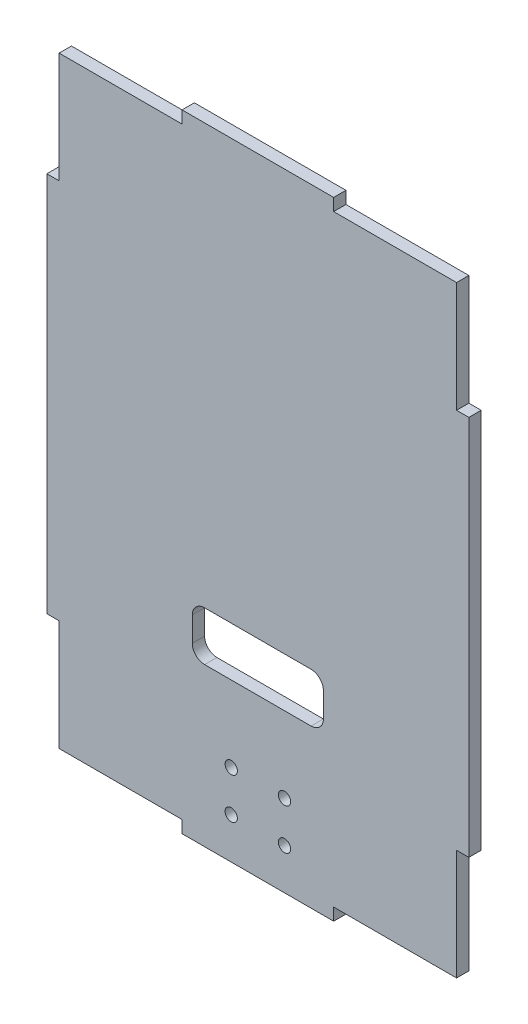
from build123d import *

# Parameters (mm, degrees)
ESBO_O1_W                = 103
ESBO_O1_H                = 153
RESSALTO_EXTRUS_O1_DEPTH = 3
ESBO_O2_W                = 32
ESBO_O2_H                = 12
CORTE_EXTRUS_O1_DEPTH    = 93.268629555
FILETE1_R                = 3
ESBO_O3_W                = 33
ESBO_O3_H                = 3
CORTE_EXTRUS_O2_DEPTH    = 93.268629555
ESBO_O4_W                = 3
ESBO_O4_H                = 27
ESBO_O4_R                = 1.5
CORTE_EXTRUS_O3_DEPTH    = 93.268629555


with BuildPart() as part:
    # Esboço1 → Ressalto-extrusão1 (new body)
    with BuildSketch(Plane.XY):
        Rectangle(ESBO_O1_W, ESBO_O1_H)
    extrude(amount=RESSALTO_EXTRUS_O1_DEPTH)

    # Esboço2 → Corte-extrusão1 (cut, through all)
    with BuildSketch(Plane.XY.offset(3)):
        with Locations((0, -32)):
            Rectangle(ESBO_O2_W, ESBO_O2_H)
    extrude(amount=-CORTE_EXTRUS_O1_DEPTH, mode=Mode.SUBTRACT)

    # Filete1
    filete1_edges = [part.edges().sort_by_distance(p)[0] for p in [
        (16, -26, 1.5),
        (16, -38, 1.5),
        (-16, -38, 1.5),
        (-16, -26, 1.5),
    ]]
    fillet(filete1_edges, radius=FILETE1_R)

    # Esboço3 → Corte-extrusão2 (cut, through all)
    with BuildSketch(Plane(origin=(0, 0, 0), x_dir=(-1, 0, 0), z_dir=(0, 0, -1))):
        with Locations((35, -75)):
            Rectangle(ESBO_O3_W, ESBO_O3_H)
        with Locations((-35, -75)):
            Rectangle(ESBO_O3_W, ESBO_O3_H)
        with Locations((35, 75)):
            Rectangle(ESBO_O3_W, ESBO_O3_H)
        with Locations((-35, 75)):
            Rectangle(ESBO_O3_W, ESBO_O3_H)
    extrude(amount=-CORTE_EXTRUS_O2_DEPTH, mode=Mode.SUBTRACT)

    # Esboço4 → Corte-extrusão3 (cut, through all)
    with BuildSketch(Plane(origin=(0, 0, 0), x_dir=(-1, 0, 0), z_dir=(0, 0, -1))):
        with Locations((50, 60)):
            Rectangle(ESBO_O4_W, ESBO_O4_H)
        with Locations((50, -60)):
            Rectangle(ESBO_O4_W, ESBO_O4_H)
        with Locations((-50, -60)):
            Rectangle(ESBO_O4_W, ESBO_O4_H)
        with Locations((-50, 60)):
            Rectangle(ESBO_O4_W, ESBO_O4_H)
        with Locations((-6.5, -66.5)):
            Circle(ESBO_O4_R)
        with Locations((-6.5, -56.5)):
            Circle(ESBO_O4_R)
        with Locations((6.5, -66.5)):
            Circle(ESBO_O4_R)
        with Locations((6.5, -56.5)):
            Circle(ESBO_O4_R)
    extrude(amount=-CORTE_EXTRUS_O3_DEPTH, mode=Mode.SUBTRACT)


solid = part.part
